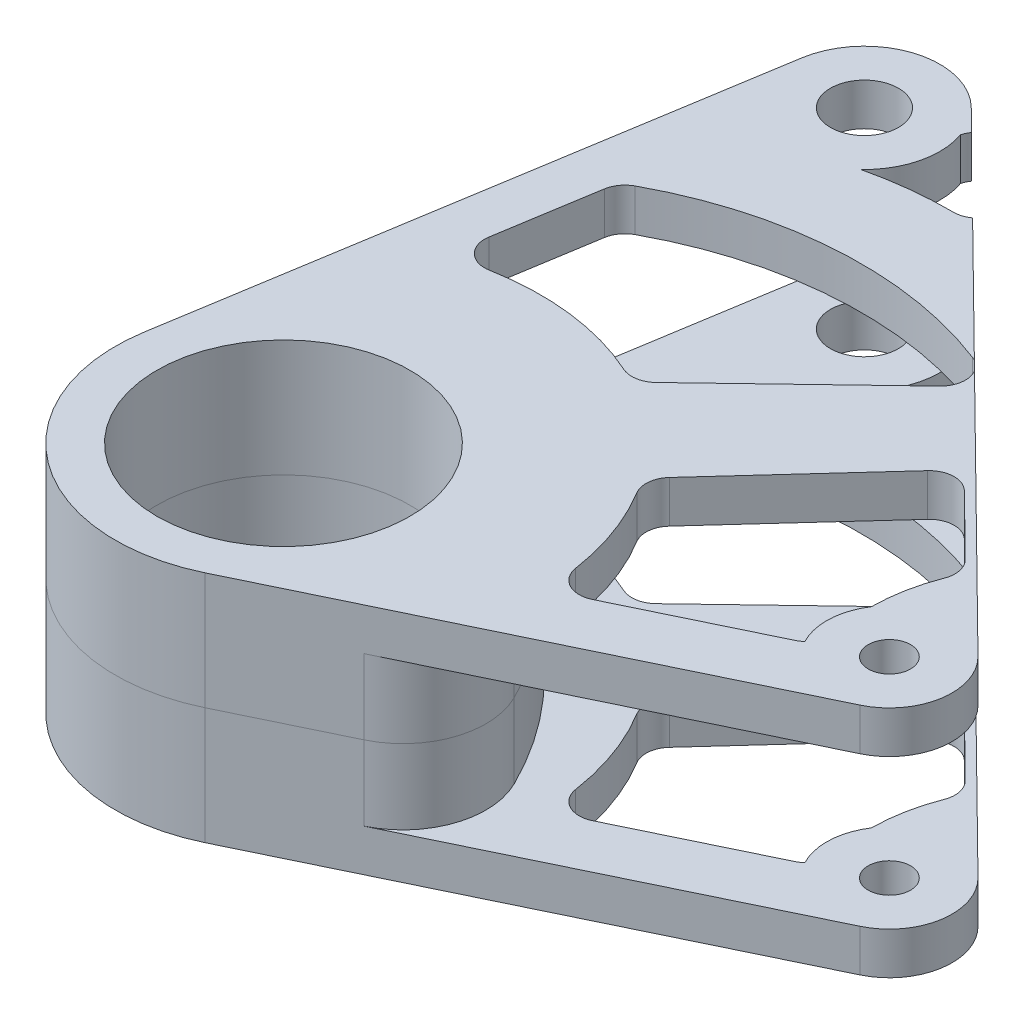
from build123d import *

# Parameters (mm, degrees)
SKETCH1_R           = 15.25
SKETCH1_R_2         = 4.1
SKETCH1_R_3         = 2.55
BOSS_EXTRUDE1_DEPTH = 5.08
CUT_EXTRUDE1_DEPTH  = 104.357750841
SKETCH2_R           = 15.25
BOSS_EXTRUDE2_DEPTH = 9


with BuildPart() as part:
    # Sketch1 → Boss-Extrude1 (new body)
    with BuildSketch(Plane(origin=(0, 0, 0), x_dir=(1, 0, 0), z_dir=(0, 1, 0))):
        with BuildLine():
            ThreePointArc((6.388793728, 76.480224896), (-2.830297402, 78.648665598), (-8.98381599, 71.4495))
            Line((-8.98381599, 71.4495), (-19.99145866, 3.225535714))
            ThreePointArc((-19.99145866, 3.225535714), (-12.108045484, -16.231381166), (8.788641521, -18.243417449))
            Line((8.788641521, -18.243417449), (62.060818364, 7.420089218))
            ThreePointArc((62.060818364, 7.420089218), (66.231922008, 12.984242387), (64.084658197, 19.598406297))
            Line((64.084658197, 19.598406297), (6.388793728, 76.480224896))
        make_face()
        with Locations(Location((0, 0, 0), (0, 0, 270))):
            Circle(SKETCH1_R, mode=Mode.SUBTRACT)
        with Locations(Location((0, 70, 0), (0, 0, 270))):
            Circle(SKETCH1_R_2, mode=Mode.SUBTRACT)
        with Locations(Location((58.784065599, 14.221955971, 0), (0, 0, 270))):
            Circle(SKETCH1_R_3, mode=Mode.SUBTRACT)
    extrude(amount=BOSS_EXTRUDE1_DEPTH)

    # Sketch3 → Cut-Extrude1 (cut, through all)
    with BuildSketch(Plane(origin=(0, 5.08, 0), x_dir=(1, 0, 0), z_dir=(0, 1, 0))):
        with BuildLine():
            ThreePointArc((8.600301495, 72.974023234), (8.830276845, 67.800861343), (6.200943015, 63.33979687))
            ThreePointArc((6.200943015, 63.33979687), (11.186994823, 64.207277059), (16.240998391, 64.472385422))
            ThreePointArc((16.240998391, 64.472385422), (17.166470838, 64.611402608), (18.00407674, 65.028824916))
            Line((18.00407674, 65.028824916), (9.02432344, 73.881880555))
            ThreePointArc((9.02432344, 73.881880555), (8.77414149, 73.445779951), (8.600301495, 72.974023234))
        make_face()
        with BuildLine():
            Line((34.099858287, 49.160142912), (32.958846213, 50.285056151))
            ThreePointArc((32.958846213, 50.285056151), (32.774050848, 50.379706816), (32.58315136, 50.461349092))
            ThreePointArc((32.58315136, 50.461349092), (13.185320482, 53.452715312), (-5.677316258, 48.028229173))
            ThreePointArc((-5.677316258, 48.028229173), (-6.694823792, 47.126566129), (-7.209864768, 45.868372734))
            Line((-7.209864768, 45.868372734), (-9.14210444, 33.892597873))
            ThreePointArc((-9.14210444, 33.892597873), (-8.27727116, 31.269243094), (-5.634779955, 30.464776107))
            ThreePointArc((-5.634779955, 30.464776107), (3.748269643, 30.753923377), (12.787186342, 28.219517959))
            ThreePointArc((12.787186342, 28.219517959), (14.529455805, 27.994719178), (16.098886301, 28.783975343))
            Line((16.098886301, 28.783975343), (33.573138468, 45.495752457))
            ThreePointArc((33.573138468, 45.495752457), (34.469127397, 47.237013531), (34.099858287, 49.160142912))
        make_face()
        with BuildLine():
            ThreePointArc((51.379712462, 10.247922916), (51.752895163, 10.461938371), (52.091630475, 10.727129493))
            ThreePointArc((52.091630475, 10.727129493), (51.243569136, 14.600655176), (52.47545713, 18.369721535))
            ThreePointArc((52.47545713, 18.369721535), (52.841609732, 22.111780263), (53.882830405, 25.724664257))
            ThreePointArc((53.882830405, 25.724664257), (54.022128776, 27.441380165), (53.194351236, 28.951778089))
            Line((53.194351236, 28.951778089), (45.982611804, 36.061765224))
            ThreePointArc((45.982611804, 36.061765224), (43.797075038, 36.924377996), (41.660206693, 35.947410531))
            Line((41.660206693, 35.947410531), (26.817680132, 19.679151335))
            ThreePointArc((26.817680132, 19.679151335), (26.047876945, 17.946527743), (26.470681024, 16.098334526))
            ThreePointArc((26.470681024, 16.098334526), (29.131872304, 10.544540978), (30.64197964, 4.574102331))
            ThreePointArc((30.64197964, 4.574102331), (32.205598333, 2.365574193), (34.911124199, 2.31429321))
            Line((34.911124199, 2.31429321), (51.379712462, 10.247922916))
        make_face()
    extrude(amount=-CUT_EXTRUDE1_DEPTH, mode=Mode.SUBTRACT)

    # Sketch2 → Boss-Extrude2 (add)
    with BuildSketch(Plane(origin=(0, 5.08, 0), x_dir=(1, 0, 0), z_dir=(0, 1, 0))):
        with BuildLine():
            Line((8.788641521, -18.243417449), (21.739699458, -12.004333908))
            ThreePointArc((21.739699458, -12.004333908), (26.855071446, -6.250176498), (26.365507295, 1.433421945))
            ThreePointArc((26.365507295, 1.433421945), (13.414022408, 17.638190532), (-5.122751892, 26.950734989))
            ThreePointArc((-5.122751892, 26.950734989), (-13.080870345, 25.624316472), (-17.469770841, 18.854634956))
            Line((-17.469770841, 18.854634956), (-19.99145866, 3.225535714))
            ThreePointArc((-19.99145866, 3.225535714), (-12.108045484, -16.231381166), (8.788641521, -18.243417449))
        make_face()
        with Locations(Location((0, 0, 0), (0, 0, 270))):
            Circle(SKETCH2_R, mode=Mode.SUBTRACT)
    extrude(amount=BOSS_EXTRUDE2_DEPTH)


with BuildPart() as body_2:
    # Mirror1: mirrored copy
    add(part.part.mirror(Plane.ZX.offset(14.08)))


solid = Compound([part.part, body_2.part])
